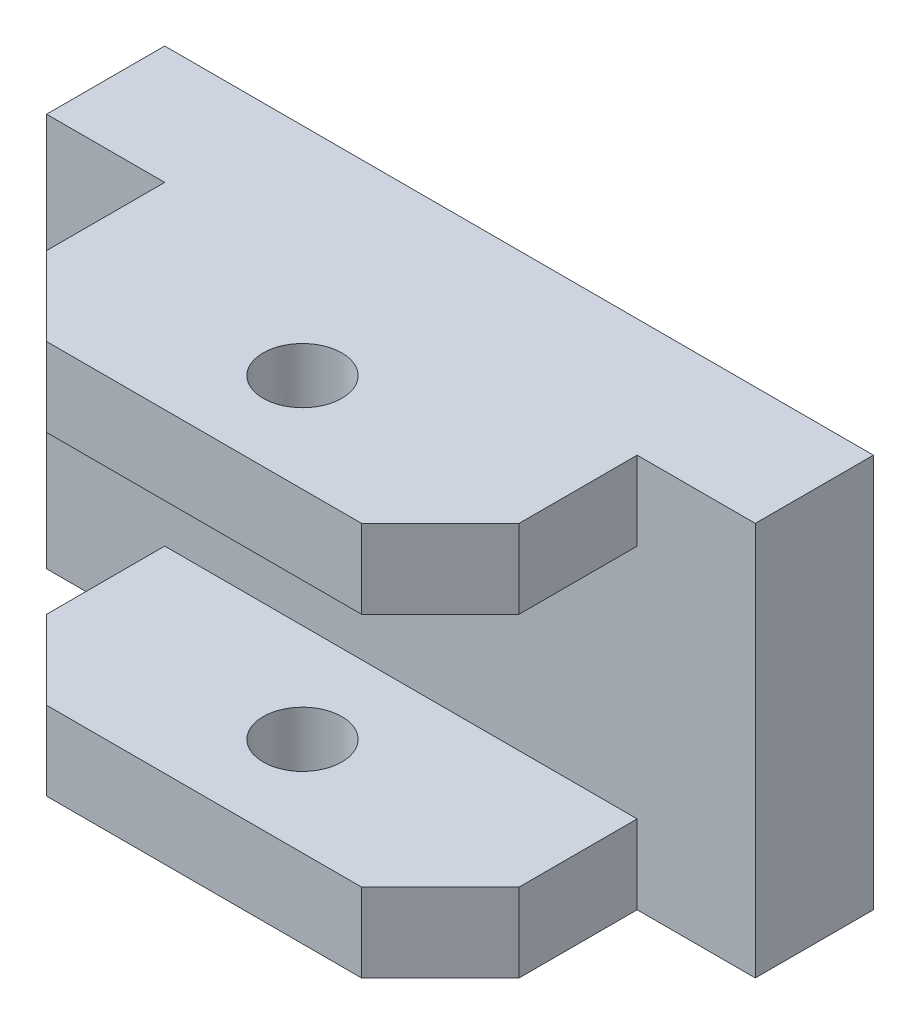
from build123d import *

# Parameters (mm, degrees)
SKETCH3_W           = 90
SKETCH3_H           = 50
BOSS_EXTRUDE4_DEPTH = 15
SKETCH4_W           = 60
SKETCH4_H           = 10
BOSS_EXTRUDE5_DEPTH = 25
SKETCH5_R           = 5
CUT_EXTRUDE1_DEPTH  = 79.262379212
FILLET1_SIZE        = 10


with BuildPart() as part:
    # Sketch3 → Boss-Extrude4 (new body)
    with BuildSketch(Plane.XY):
        Rectangle(SKETCH3_W, SKETCH3_H)
    extrude(amount=BOSS_EXTRUDE4_DEPTH)

    # Sketch4 → Boss-Extrude5 (add)
    with BuildSketch(Plane.XY.offset(15)):
        with Locations((0, 20)):
            Rectangle(SKETCH4_W, SKETCH4_H)
        with Locations((0, -20)):
            Rectangle(SKETCH4_W, SKETCH4_H)
    extrude(amount=BOSS_EXTRUDE5_DEPTH)

    # Sketch5 → Cut-Extrude1 (cut, through all)
    with BuildSketch(Plane.XZ.offset(25)):
        with Locations(Location((0, 27.5, 0), (0, 0, 270))):
            Circle(SKETCH5_R)
    extrude(amount=-CUT_EXTRUDE1_DEPTH, mode=Mode.SUBTRACT)

    # Fillet1
    fillet1_edges = [part.edges().sort_by_distance(p)[0] for p in [
        (-30, 20, 40),
        (30, 20, 40),
        (30, -20, 40),
        (-30, -20, 40),
    ]]
    chamfer(fillet1_edges, length=FILLET1_SIZE)


solid = part.part
